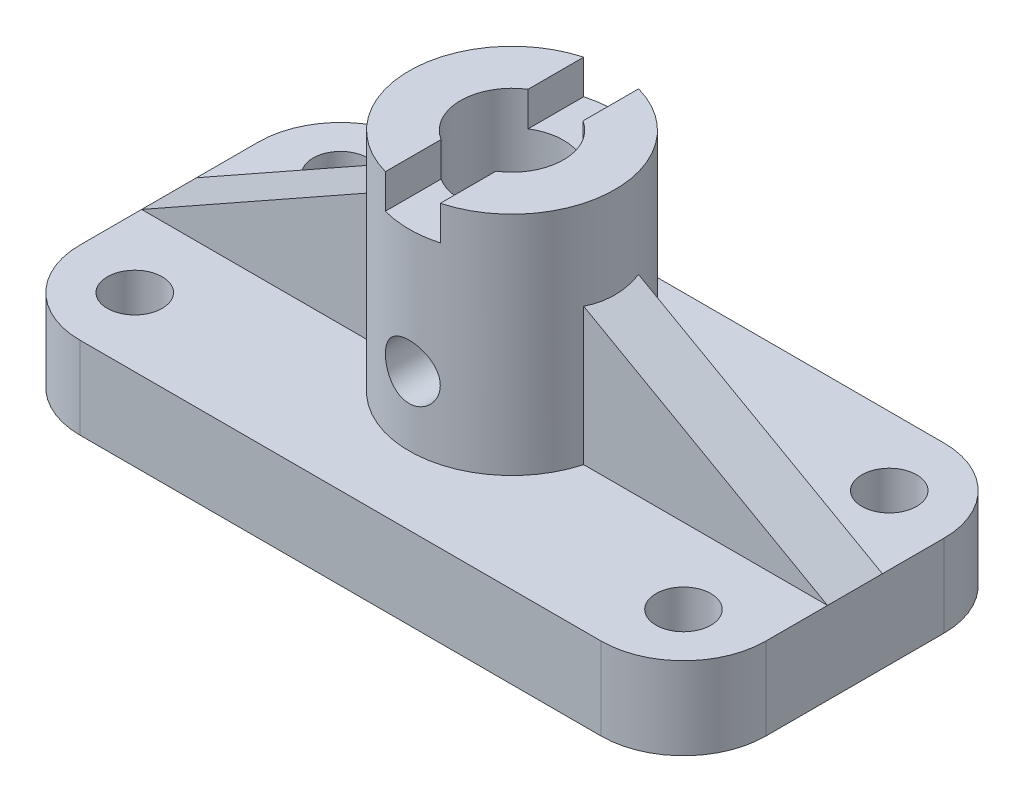
from build123d import *

# Parameters (mm, degrees)
EXTRUDE_1_DEPTH          = 12
SKETCH_2_R               = 3.999999999999999
CUT_EXTRUDE_2_DEPTH      = 58.17516943569124
EXTRUDE_2_DEPTH          = 20
CUT_EXTRUDE_3_DEPTH      = 67.06814663663573
CUT_EXTRUDE_4_DEPTH      = 67.06814663663573
SKETCH_7_R               = 7.5
CUT_EXTRUDE_5_DEPTH      = 65.41273166075167
EXTRUDE_START            = -20
SKETCH_8_R               = 15
SKETCH_8_R_2             = 7.499999999999999
EXTRUDE_3_DEPTH          = 20
SKETCH_10_R              = 15
SKETCH_10_R_2            = 7.500000000000001
EXTRUDE_4_DEPTH          = 13
SKETCH_11_OUTSIDE_W      = 126.10400000000001
SKETCH_11_OUTSIDE_H      = 76.104
CUT_EXTRUDE_7_DEPTH      = 5
CUT_EXTRUDE_8_DEPTH      = 72.76350047203664
CUT_EXTRUDE_8_DEPTH_BACK = 72.76350047203664
SKETCH_12_R              = 4


with BuildPart() as part:
    # 草图1 → 凸台-拉伸1 (new body)
    with BuildSketch(Plane(origin=(0, 0, 0), x_dir=(1, 0, 0), z_dir=(0, 1, 0))):
        with BuildLine():
            Line((37.99999999999992, 25.00000000000001), (-37.999999999999915, 25))
            ThreePointArc((-37.999999999999915, 25), (-46.48528137423857, 21.485281374238575), (-50, 12.999999999999913))
            Line((-50, 12.999999999999913), (-49.99999999999999, -12.99999999999992))
            ThreePointArc((-49.99999999999999, -12.99999999999992), (-46.48528137423857, -21.48528137423858), (-37.99999999999991, -25.000000000000004))
            Line((-37.99999999999991, -25.000000000000004), (37.99999999999992, -24.999999999999993))
            ThreePointArc((37.99999999999992, -24.999999999999993), (46.48528137423858, -21.48528137423856), (50.00000000000001, -12.999999999999908))
            Line((50.00000000000001, -12.999999999999908), (50.00000000000001, 12.999999999999927))
            ThreePointArc((50.00000000000001, 12.999999999999927), (46.48528137423858, 21.485281374238582), (37.99999999999992, 25.00000000000001))
        make_face()
    extrude(amount=EXTRUDE_1_DEPTH)

    # 草图2 → 切除-拉伸2 (cut, through all)
    with BuildSketch(Plane(origin=(0, 12, 0), x_dir=(1, 0, 0), z_dir=(0, 1, 0))):
        with Locations(Location((-39.99999999999999, -15, 0), (0, 0, 270))):
            Circle(SKETCH_2_R)
        with Locations(Location((39.99999999999999, -15, 0), (0, 0, 90))):
            Circle(SKETCH_2_R)
        with Locations(Location((39.99999999999999, 15, 0), (0, 0, 270))):
            Circle(SKETCH_2_R)
        with Locations(Location((-39.99999999999999, 15, 0), (0, 0, 90))):
            Circle(SKETCH_2_R)
    extrude(amount=-CUT_EXTRUDE_2_DEPTH, mode=Mode.SUBTRACT)

    # 草图4 → 凸台-拉伸2 (add)
    with BuildSketch(Plane(origin=(0, 12, 0), x_dir=(1, 0, 0), z_dir=(0, 1, 0))):
        with BuildLine():
            Line((-50, -4), (-14.456832294800959, -4.000000000000001))
            ThreePointArc((-14.456832294800959, -4.000000000000001), (9.2e-16, -14.999999999999998), (14.456832294800959, -4))
            Line((14.456832294800959, -4), (50.00000000000001, -3.9999999999999982))
            Line((50.00000000000001, -3.9999999999999982), (50.00000000000001, 3.9999999999999982))
            Line((50.00000000000001, 3.9999999999999982), (14.456832294800959, 4))
            ThreePointArc((14.456832294800959, 4), (9.2e-16, 14.999999999999998), (-14.456832294800959, 4.000000000000001))
            Line((-14.456832294800959, 4.000000000000001), (-50, 4))
            Line((-50, 4), (-50, -4))
        make_face()
    extrude(amount=EXTRUDE_2_DEPTH)

    # 草图5 → 切除-拉伸3 (cut, through all)
    with BuildSketch(Plane.XY.offset(4.000000000000001)):
        Polygon((-14.456832294800959, 32), (-49.99999999999999, 12), (-50, 32), align=None)
    extrude(amount=-CUT_EXTRUDE_3_DEPTH, mode=Mode.SUBTRACT)

    # 草图6 → 切除-拉伸4 (cut, through all)
    with BuildSketch(Plane.XY.offset(4.000000000000001)):
        Polygon((14.456832294800959, 32), (50.00000000000001, 12), (50.00000000000001, 32), align=None)
    extrude(amount=-CUT_EXTRUDE_4_DEPTH, mode=Mode.SUBTRACT)

    # 草图7 → 切除-拉伸5 (cut, through all)
    with BuildSketch(Plane(origin=(0, 32, 0), x_dir=(1, 0, 0), z_dir=(0, 1, 0))):
        with Locations(Location((0, 0, 0), (0, 0, 270))):
            Circle(SKETCH_7_R)
    extrude(amount=-CUT_EXTRUDE_5_DEPTH, mode=Mode.SUBTRACT)

    # 草图8 → 凸台-拉伸3 (add)
    with BuildSketch(Plane(origin=(0, 32, 0), x_dir=(1, 0, 0), z_dir=(0, 1, 0)).offset(EXTRUDE_START)):
        Circle(SKETCH_8_R)
        with Locations(Location((0, 0, 0), (0, 0, 270))):
            Circle(SKETCH_8_R_2, mode=Mode.SUBTRACT)
    extrude(amount=EXTRUDE_3_DEPTH)

    # 草图10 → 凸台-拉伸4 (add)
    with BuildSketch(Plane(origin=(0, 32, 0), x_dir=(1, 0, 0), z_dir=(0, 1, 0))):
        with Locations(Location((0, 0, 0), (0, 0, 164.533990047))):
            Circle(SKETCH_10_R)
        with Locations(Location((0, 0, 0), (0, 0, 270))):
            Circle(SKETCH_10_R_2, mode=Mode.SUBTRACT)
    extrude(amount=EXTRUDE_4_DEPTH)

    # 草图11 outside → 切除-拉伸7 (cut)
    with BuildSketch(Plane(origin=(0, 45, 0), x_dir=(1, 0, 0), z_dir=(0, 1, 0))):
        Rectangle(SKETCH_11_OUTSIDE_W, SKETCH_11_OUTSIDE_H)
        with BuildLine():
            Line((4.000000000000002, -6.34428877022476), (4.000000000000003, -14.456832294800959))
            ThreePointArc((4.000000000000003, -14.456832294800959), (15, 0), (4.000000000000003, 14.456832294800959))
            Line((4.000000000000003, 14.456832294800959), (4.000000000000002, 6.34428877022476))
            ThreePointArc((4.000000000000002, 6.34428877022476), (7.500000000000001, 0), (4.000000000000002, -6.34428877022476))
        make_face(mode=Mode.SUBTRACT)
        with BuildLine():
            Line((-4.000000000000002, -6.34428877022476), (-4.000000000000003, -14.456832294800959))
            ThreePointArc((-4.000000000000003, -14.456832294800959), (-15, 1.84e-15), (-4.000000000000003, 14.456832294800959))
            Line((-4.000000000000003, 14.456832294800959), (-4.000000000000002, 6.34428877022476))
            ThreePointArc((-4.000000000000002, 6.34428877022476), (-7.500000000000001, 9.2e-16), (-4.000000000000002, -6.34428877022476))
        make_face(mode=Mode.SUBTRACT)
    extrude(amount=-CUT_EXTRUDE_7_DEPTH, mode=Mode.SUBTRACT)

    # 草图12 → 切除-拉伸8 (cut, two sides: drawn at the far end of the back side and taken through both)
    with BuildSketch(Plane.XY.offset(-CUT_EXTRUDE_8_DEPTH_BACK)):
        with Locations((0, 22)):
            Circle(SKETCH_12_R)
    extrude(amount=CUT_EXTRUDE_8_DEPTH + CUT_EXTRUDE_8_DEPTH_BACK, mode=Mode.SUBTRACT)


solid = part.part
